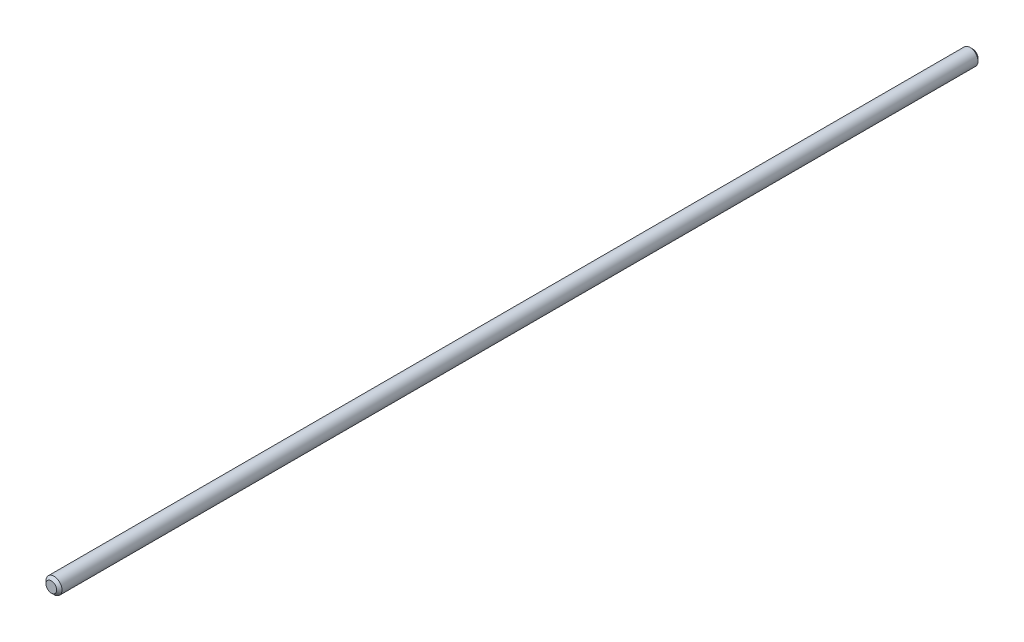
from build123d import *

# Parameters (mm, degrees)
SKETCH_1_R      = 1.5
EXTRUDE_1_DEPTH = 172.8
CHAMFER_1_SIZE  = 0.5


with BuildPart() as part:
    # Эскиз1 → Бобышка-Вытянуть1 (new body)
    with BuildSketch(Plane.XY):
        with Locations(Location((0, 0, 0), (0, 0, 180))):
            Circle(SKETCH_1_R)
    extrude(amount=EXTRUDE_1_DEPTH)

    # Фаска1
    chamfer_1_edges = [part.edges().sort_by_distance(p)[0] for p in [
        (1.5, 0, 0),
        (1.5, 0, 172.8),
    ]]
    chamfer(chamfer_1_edges, length=CHAMFER_1_SIZE)


solid = part.part
